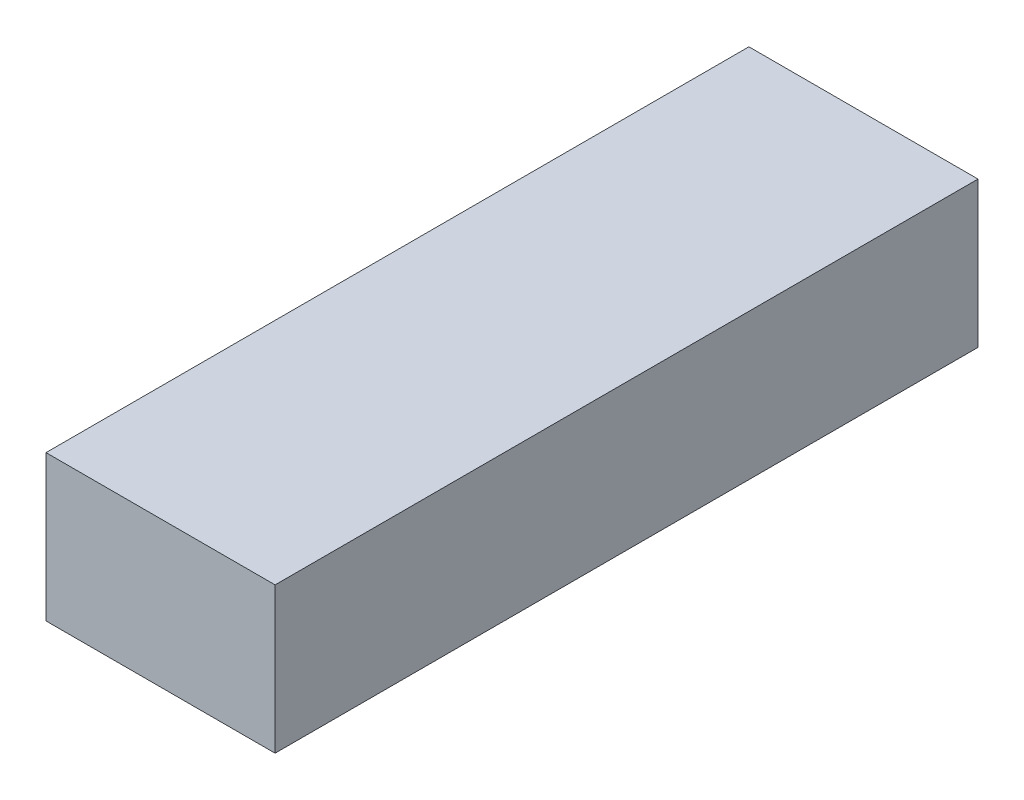
from build123d import *

# Parameters (mm, degrees)
SKETCH1_W           = 44
SKETCH1_H           = 135
BOSS_EXTRUDE1_DEPTH = 28


with BuildPart() as part:
    # Sketch1 → Boss-Extrude1 (new body)
    with BuildSketch(Plane(origin=(0, 0, 0), x_dir=(1, 0, 0), z_dir=(0, 1, 0))):
        with Locations((22, 67.5)):
            Rectangle(SKETCH1_W, SKETCH1_H)
    extrude(amount=BOSS_EXTRUDE1_DEPTH)


solid = part.part
